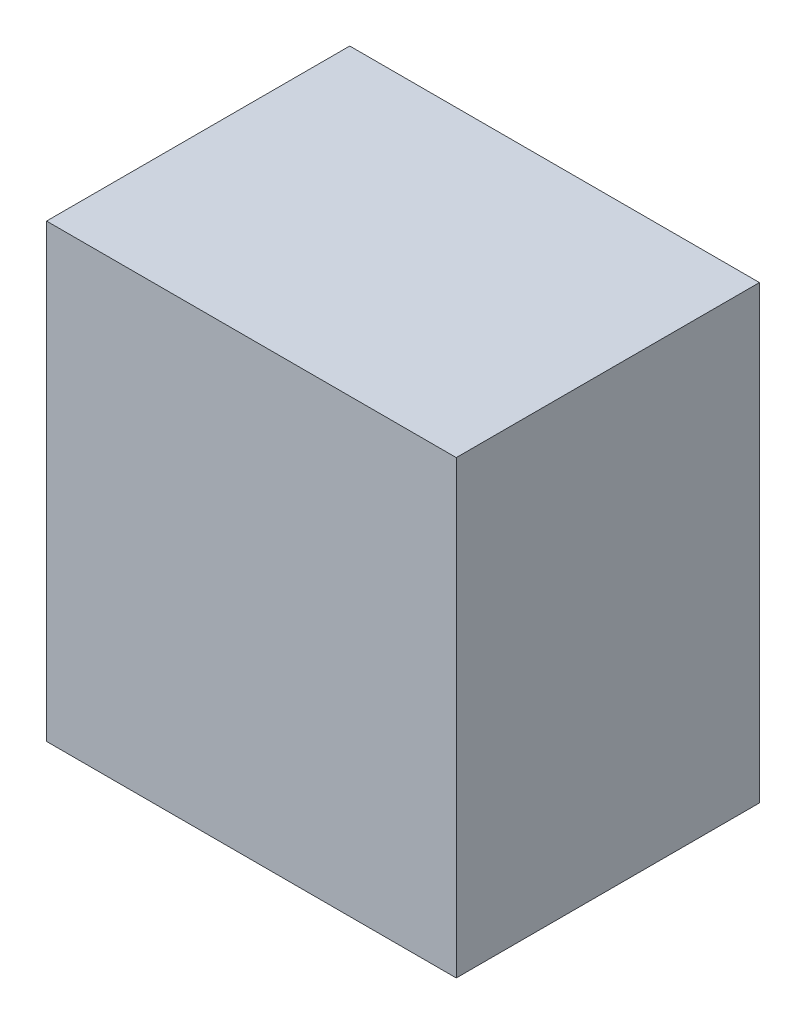
from build123d import *

# Parameters (mm, degrees)
ESQUISSE1_W        = 50
ESQUISSE1_H        = 55
BOSS_EXTRU_1_DEPTH = 37
ESQUISSE2_R        = 7.5
BOSS_EXTRU_2_DEPTH = 10
CONG_3_R           = 2


with BuildPart() as part:
    # Esquisse1 → Boss.-Extru.1 (new body)
    with BuildSketch(Plane.XY):
        Rectangle(ESQUISSE1_W, ESQUISSE1_H)
    extrude(amount=BOSS_EXTRU_1_DEPTH)

    # Esquisse2 → Boss.-Extru.2 (add)
    with BuildSketch(Plane.XY):
        Circle(ESQUISSE2_R)
    extrude(amount=-BOSS_EXTRU_2_DEPTH)

    # Congé3
    cong_3_edges = [part.edges().sort_by_distance(p)[0] for p in [
        (-7.5, 0, -10),
    ]]
    fillet(cong_3_edges, radius=CONG_3_R)


solid = part.part
